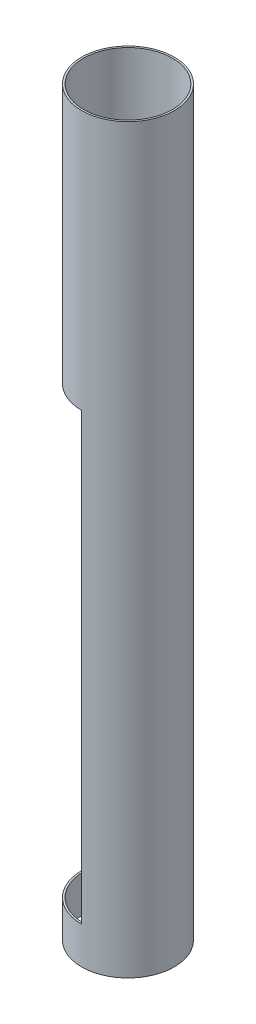
from build123d import *

# Parameters (mm, degrees)
BOSS_EXTRU_1_DEPTH           = 200
BOSS_EXTRU_1_DEPTH_BACK      = 200
ESQUISSE1_R                  = 25
ESQUISSE2_R                  = 24
ENL_V_MAT_EXTRU_1_DEPTH      = 400
ENL_V_MAT_EXTRU_2_DEPTH      = 60
ENL_V_MAT_EXTRU_2_DEPTH_BACK = 180
ESQUISSE3_W                  = 240
ESQUISSE3_H                  = 600


with BuildPart() as part:
    # Esquisse1 → Boss.-Extru.1 (new, two sides: drawn at the far end of the back side and taken through both)
    with BuildSketch(Plane(origin=(0, 0, 0), x_dir=(1, 0, 0), z_dir=(0, 1, 0)).offset(-BOSS_EXTRU_1_DEPTH_BACK)):
        Circle(ESQUISSE1_R)
    extrude(amount=BOSS_EXTRU_1_DEPTH + BOSS_EXTRU_1_DEPTH_BACK)

    # Esquisse2 → Enlèv. mat.-Extru.1 (cut)
    with BuildSketch(Plane(origin=(0, 200, 0), x_dir=(1, 0, 0), z_dir=(0, 1, 0))):
        Circle(ESQUISSE2_R)
    extrude(amount=-ENL_V_MAT_EXTRU_1_DEPTH, mode=Mode.SUBTRACT)

    # Esquisse3 → Enlèv. mat.-Extru.2 (cut, two sides: drawn at the far end of the back side and taken through both)
    with BuildSketch(Plane(origin=(0, 0, 0), x_dir=(1, 0, 0), z_dir=(0, 1, 0)).offset(-ENL_V_MAT_EXTRU_2_DEPTH_BACK)):
        with Locations((-120, 0)):
            Rectangle(ESQUISSE3_W, ESQUISSE3_H)
    extrude(amount=ENL_V_MAT_EXTRU_2_DEPTH + ENL_V_MAT_EXTRU_2_DEPTH_BACK, mode=Mode.SUBTRACT)


solid = part.part
